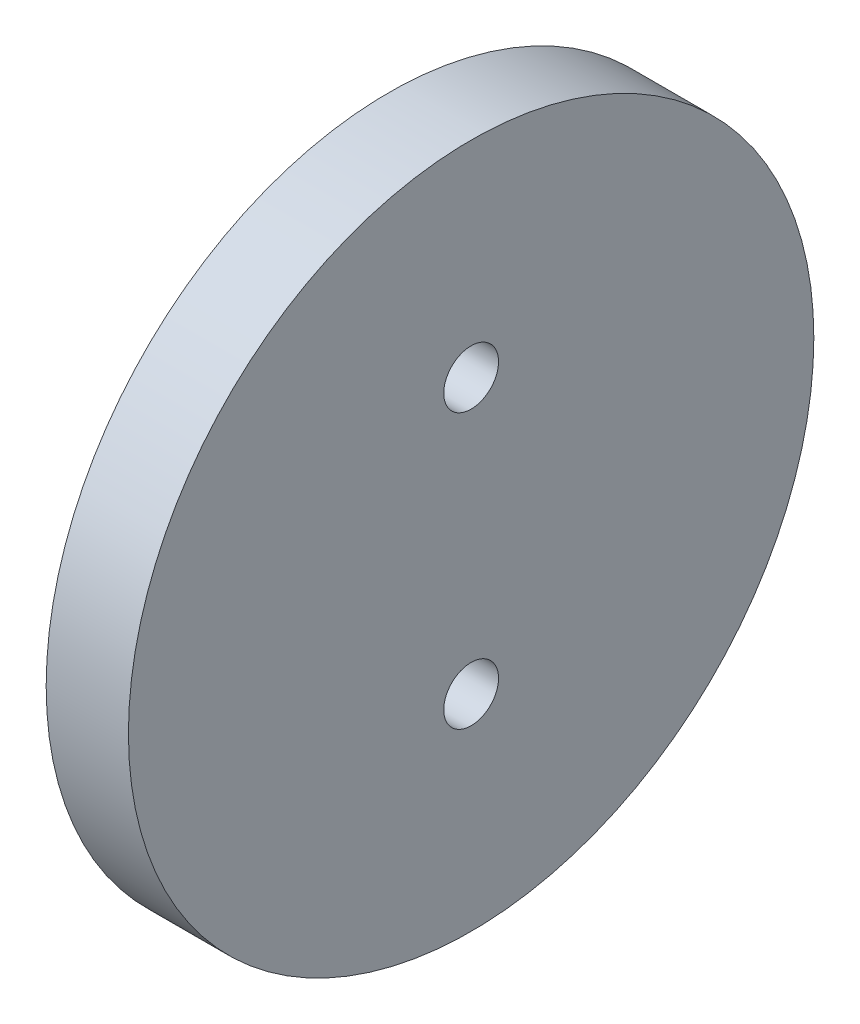
from build123d import *

# Parameters (mm, degrees)
SKETCH_1_R          = 12.5
EXTRUDE_1_DEPTH     = 3
SKETCH_2_R          = 1
CUT_EXTRUDE_1_DEPTH = 3


with BuildPart() as part:
    # 草图1 → 凸台-拉伸1 (new body)
    with BuildSketch(Plane(origin=(0, 0, 0), x_dir=(0, 0, -1), z_dir=(1, 0, 0))):
        Circle(SKETCH_1_R)
    extrude(amount=EXTRUDE_1_DEPTH)

    # 草图2 → 切除-拉伸1 (cut)
    with BuildSketch(Plane(origin=(3, 0, 0), x_dir=(0, 0, -1), z_dir=(1, 0, 0))):
        with Locations((0, 5)):
            Circle(SKETCH_2_R)
        with Locations((0, -5)):
            Circle(SKETCH_2_R)
    extrude(amount=-CUT_EXTRUDE_1_DEPTH, mode=Mode.SUBTRACT)


solid = part.part
